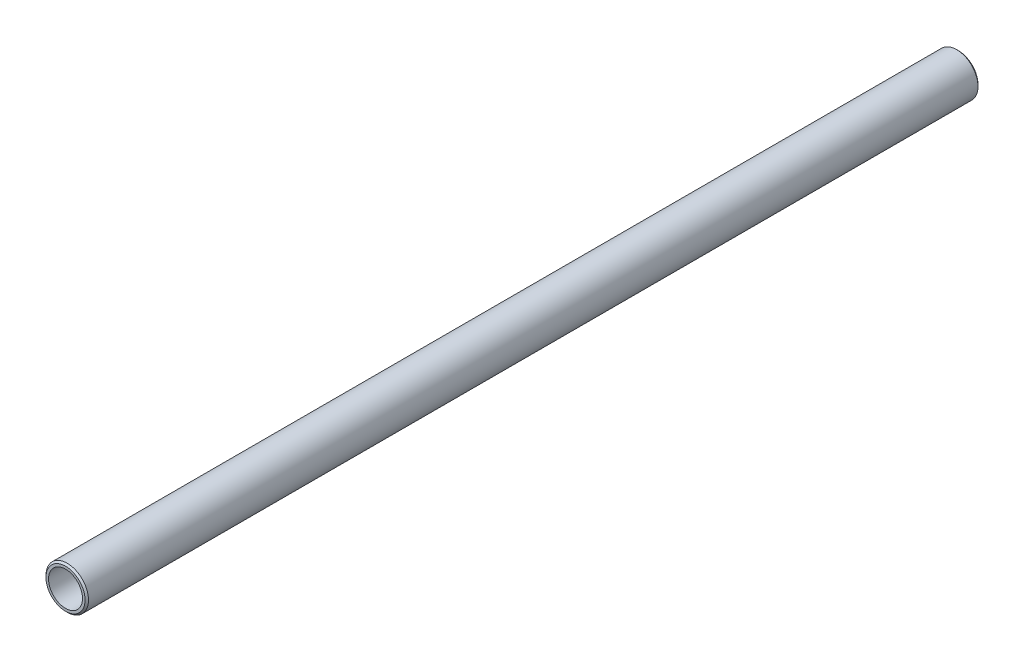
from build123d import *

# Parameters (mm, degrees)
SKETCH1_R         = 5
SKETCH1_R_2       = 4
BODY_DEPTH        = 210
END_CHAMFERS_SIZE = 0.4


with BuildPart() as part:
    # Sketch1 → body (new body)
    with BuildSketch(Plane.XY):
        Circle(SKETCH1_R)
        Circle(SKETCH1_R_2, mode=Mode.SUBTRACT)
    extrude(amount=BODY_DEPTH)

    # end_chamfers
    end_chamfers_edges = [part.edges().sort_by_distance(p)[0] for p in [
        (-5, 0, 0),
        (-5, 0, 210),
    ]]
    chamfer(end_chamfers_edges, length=END_CHAMFERS_SIZE)


solid = part.part
